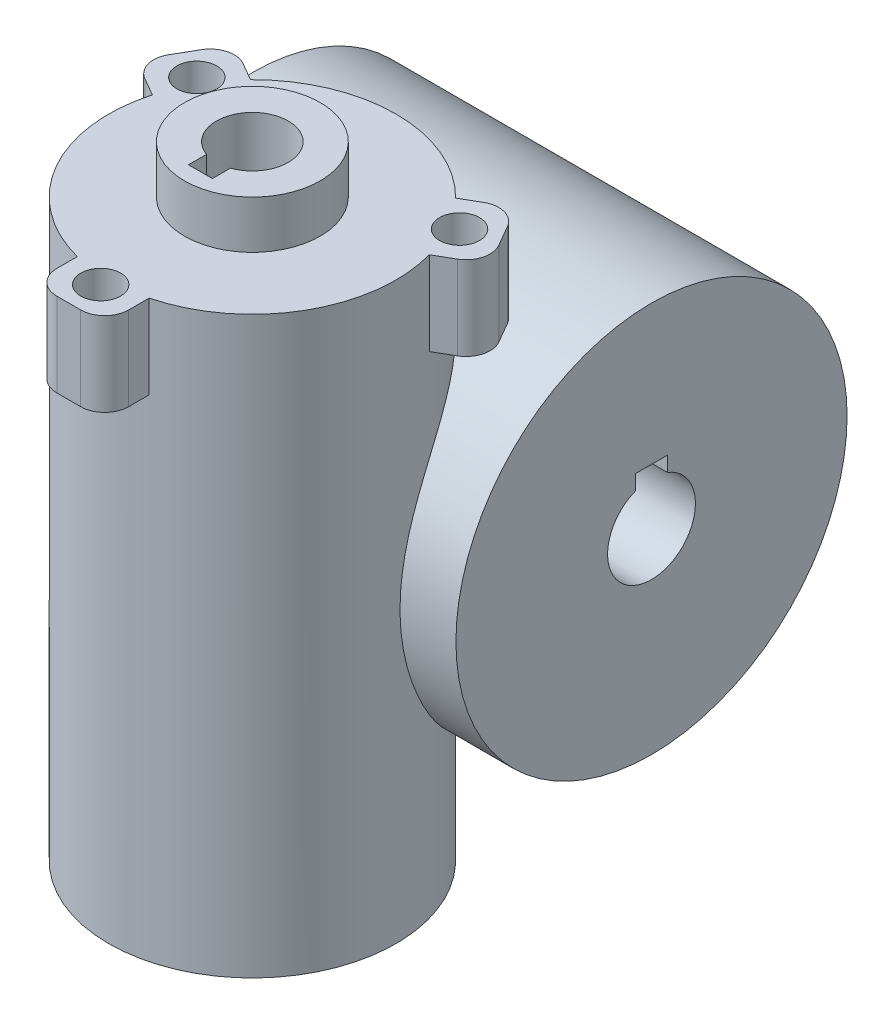
from build123d import *

# Parameters (mm, degrees)
SKETCH_1_R               = 18
EXTRUDE_1_DEPTH          = 72
EXTRUDE_2_DEPTH          = 25
EXTRUDE_2_DEPTH_BACK     = 25
SKETCH_2_R               = 24.5
CUT_EXTRUDE_1_DEPTH      = 101.669012284
SKETCH_5_R               = 8.5
EXTRUDE_3_DEPTH          = 6
CUT_EXTRUDE_2_DEPTH      = 10
CUT_EXTRUDE_2_DEPTH_BACK = 12
EXTRUDE_START            = -10.5
EXTRUDE_4_DEPTH          = 10.5
SKETCH_7_R               = 2.5
CUT_EXTRUDE_3_DEPTH      = 5


with BuildPart() as part:
    # 草图1 → 凸台-拉伸1 (new body)
    with BuildSketch(Plane(origin=(0, 0, 0), x_dir=(1, 0, 0), z_dir=(0, 1, 0))):
        Circle(SKETCH_1_R)
    extrude(amount=EXTRUDE_1_DEPTH)

    # 草图2 → 凸台-拉伸2 (add, two sides: drawn at the far end of the back side and taken through both)
    with BuildSketch(Plane(origin=(0, 0, 0), x_dir=(0, 0, -1), z_dir=(1, 0, 0)).offset(-EXTRUDE_2_DEPTH_BACK)):
        with Locations((25, 36)):
            Circle(SKETCH_2_R)
    extrude(amount=EXTRUDE_2_DEPTH + EXTRUDE_2_DEPTH_BACK)

    # 草图3 → 切除-拉伸1 (cut, through all)
    with BuildSketch(Plane(origin=(25, 0, 0), x_dir=(0, 0, -1), z_dir=(1, 0, 0))):
        with BuildLine():
            Line((23, 41.123475383), (23, 43))
            Line((23, 43), (27, 43))
            Line((27, 43), (27, 41.123475383))
            ThreePointArc((27, 41.123475383), (25, 30.5), (23, 41.123475383))
        make_face()
    extrude(amount=-CUT_EXTRUDE_1_DEPTH, mode=Mode.SUBTRACT)

    # 草图5 → 凸台-拉伸3 (add)
    with BuildSketch(Plane(origin=(0, 72, 0), x_dir=(1, 0, 0), z_dir=(0, 1, 0))):
        Circle(SKETCH_5_R)
    extrude(amount=EXTRUDE_3_DEPTH)

    # 草图4 → 切除-拉伸2 (cut, two sides: drawn at the far end of the back side and taken through both)
    with BuildSketch(Plane(origin=(0, 72, 0), x_dir=(1, 0, 0), z_dir=(0, 1, 0)).offset(-CUT_EXTRUDE_2_DEPTH_BACK)):
        with BuildLine():
            Line((-1.5, -4.242640687), (-1.5, -6.5))
            Line((-1.5, -6.5), (1.5, -6.5))
            Line((1.5, -6.5), (1.5, -4.242640687))
            ThreePointArc((1.5, -4.242640687), (0, 4.5), (-1.5, -4.242640687))
        make_face()
    extrude(amount=CUT_EXTRUDE_2_DEPTH + CUT_EXTRUDE_2_DEPTH_BACK, mode=Mode.SUBTRACT)

    # 草图6 → 凸台-拉伸4 (add)
    with BuildSketch(Plane(origin=(0, 72, 0), x_dir=(1, 0, 0), z_dir=(0, 1, 0)).offset(EXTRUDE_START)):
        with BuildLine():
            Line((-20.668584287, 10.200961894), (-19.168584287, 12.799038106))
            ThreePointArc((-19.168584287, 12.799038106), (-17.346965211, 14.196815585), (-15.070508076, 13.897114317))
            Line((-15.070508076, 13.897114317), (-12.843458848, 12.611326846))
            ThreePointArc((-12.843458848, 12.611326846), (-15.588457268, 9), (-17.343458848, 4.817098212))
            Line((-17.343458848, 4.817098212), (-19.570508076, 6.102885683))
            ThreePointArc((-19.570508076, 6.102885683), (-20.968285555, 7.924504759), (-20.668584287, 10.200961894))
        make_face()
        with BuildLine():
            Line((1.5, -23), (-1.5, -23))
            ThreePointArc((-1.5, -23), (-3.621320344, -22.121320344), (-4.5, -20))
            Line((-4.5, -20), (-4.5, -17.428425058))
            ThreePointArc((-4.5, -17.428425058), (0, -18), (4.5, -17.428425058))
            Line((4.5, -17.428425058), (4.5, -20))
            ThreePointArc((4.5, -20), (3.621320344, -22.121320344), (1.5, -23))
        make_face()
        with BuildLine():
            Line((19.168584287, 12.799038106), (20.668584287, 10.200961894))
            ThreePointArc((20.668584287, 10.200961894), (20.968285555, 7.924504759), (19.570508076, 6.102885683))
            Line((19.570508076, 6.102885683), (17.343458848, 4.817098212))
            ThreePointArc((17.343458848, 4.817098212), (15.588457268, 9), (12.843458848, 12.611326846))
            Line((12.843458848, 12.611326846), (15.070508076, 13.897114317))
            ThreePointArc((15.070508076, 13.897114317), (17.346965211, 14.196815585), (19.168584287, 12.799038106))
        make_face()
    extrude(amount=EXTRUDE_4_DEPTH)

    # 草图7 → 切除-拉伸3 (cut)
    with BuildSketch(Plane(origin=(0, 72, 0), x_dir=(1, 0, 0), z_dir=(0, 1, 0))):
        with Locations((0, -19)):
            Circle(SKETCH_7_R)
        with Locations((16.454482672, 9.5)):
            Circle(SKETCH_7_R)
        with Locations((-16.454482672, 9.5)):
            Circle(SKETCH_7_R)
    extrude(amount=-CUT_EXTRUDE_3_DEPTH, mode=Mode.SUBTRACT)


solid = part.part
